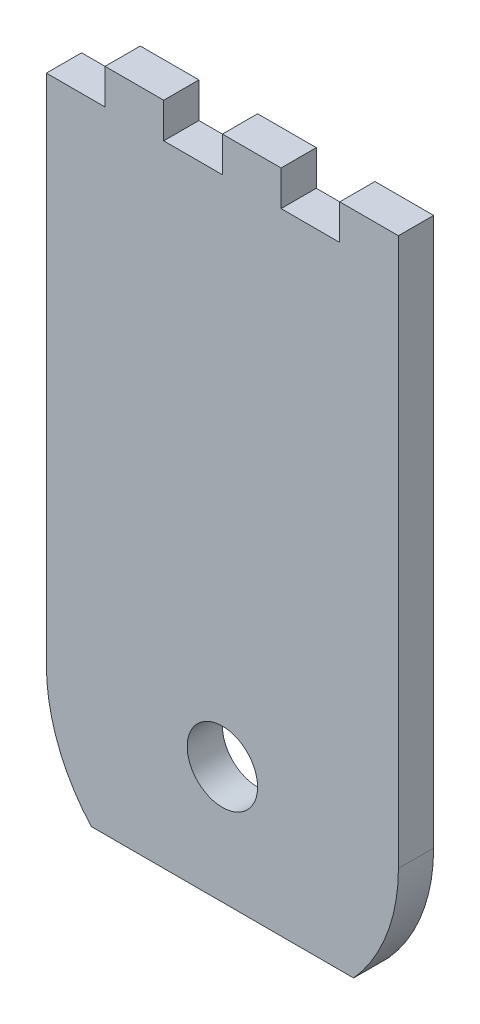
from build123d import *

# Parameters (mm, degrees)
CROQUIS1_R              = 3
SALIENTE_EXTRUIR1_DEPTH = 3
CORTAR_EXTRUIR1_DEPTH   = 3


with BuildPart() as part:
    # Croquis1 → Saliente-Extruir1 (new body)
    with BuildSketch(Plane.XY):
        Polygon((-15, -28.345), (15, -28.345), (15, 28.345), (10, 28.345), (10, 25.345), (5, 25.345), (5, 28.345), (0, 28.345), (0, 25.345), (-5, 25.345), (-5, 28.345), (-10, 28.345), (-10, 25.345), (-15, 25.345), align=None)
        with Locations((0, -18.345)):
            Circle(CROQUIS1_R, mode=Mode.SUBTRACT)
    extrude(amount=SALIENTE_EXTRUIR1_DEPTH)

    # Croquis2 → Cortar-Extruir1 (cut)
    with BuildSketch(Plane(origin=(0, 0, 0), x_dir=(-1, 0, 0), z_dir=(0, 0, -1))):
        with BuildLine():
            Line((-15, -18.345), (-21.186751232, -18.345))
            Line((-21.186751232, -18.345), (-21.186751232, -37.148085908))
            Line((-21.186751232, -37.148085908), (21.188955731, -37.148085908))
            Line((21.188955731, -37.148085908), (21.188955731, -18.345))
            Line((21.188955731, -18.345), (15, -18.345))
            ThreePointArc((15, -18.345), (0, -33.345), (-15, -18.345))
        make_face()
    extrude(amount=-CORTAR_EXTRUIR1_DEPTH, mode=Mode.SUBTRACT)


solid = part.part
